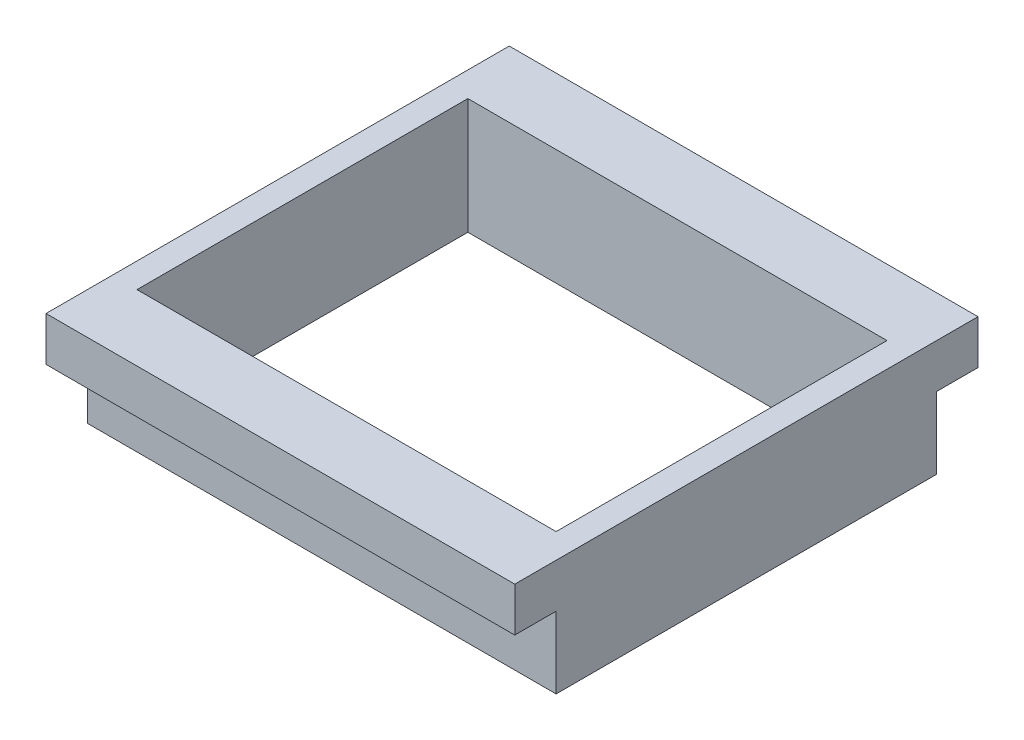
from build123d import *

# Parameters (mm, degrees)
SKETCH_1_W      = 42.5
SKETCH_1_H      = 34.5
SKETCH_1_W_2    = 38
SKETCH_1_H_2    = 30
EXTRUDE_1_DEPTH = 6.5
SKETCH_2_W      = 42.5
SKETCH_2_H      = 42
SKETCH_2_W_2    = 38
SKETCH_2_H_2    = 30
EXTRUDE_2_DEPTH = 4


with BuildPart() as part:
    # Эскиз1 → Бобышка-Вытянуть1 (new body)
    with BuildSketch(Plane(origin=(0, 0, 0), x_dir=(1, 0, 0), z_dir=(0, 1, 0))):
        Rectangle(SKETCH_1_W, SKETCH_1_H)
        Rectangle(SKETCH_1_W_2, SKETCH_1_H_2, mode=Mode.SUBTRACT)
    extrude(amount=EXTRUDE_1_DEPTH)

    # Эскиз2 → Бобышка-Вытянуть2 (add)
    with BuildSketch(Plane(origin=(0, 6.5, 0), x_dir=(1, 0, 0), z_dir=(0, 1, 0))):
        Rectangle(SKETCH_2_W, SKETCH_2_H)
        Rectangle(SKETCH_2_W_2, SKETCH_2_H_2, mode=Mode.SUBTRACT)
    extrude(amount=EXTRUDE_2_DEPTH)


solid = part.part
